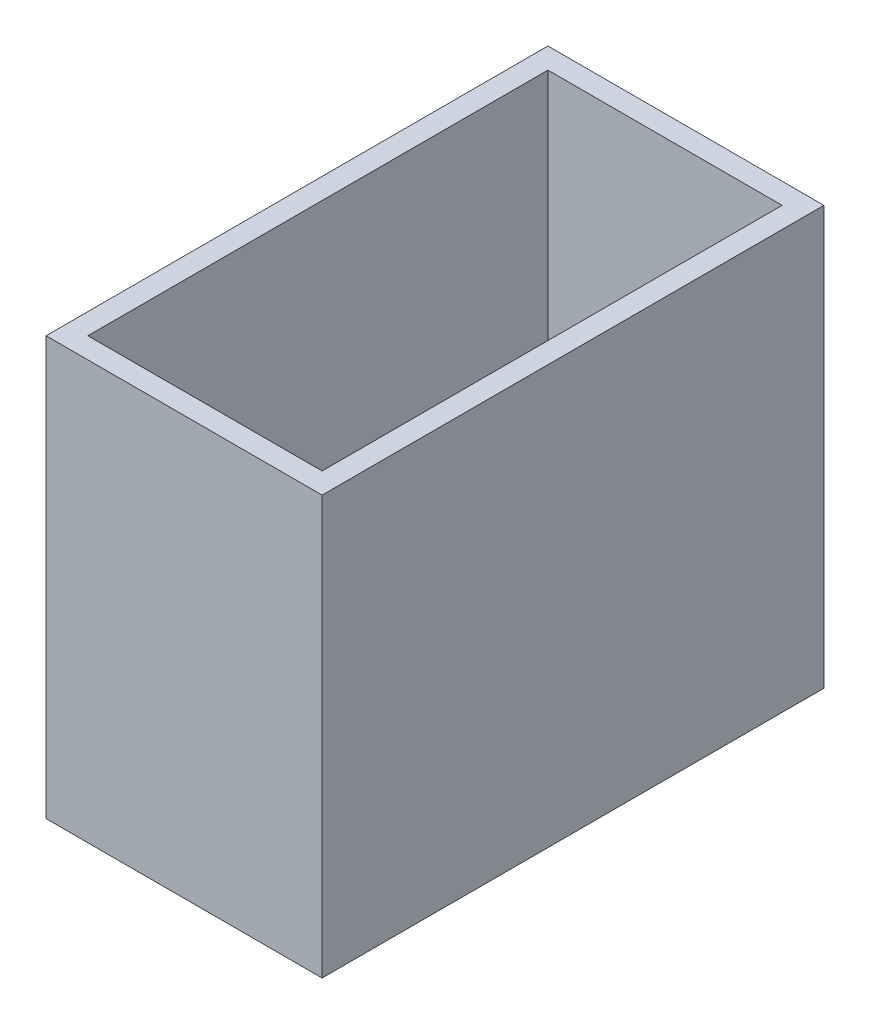
from build123d import *

# Parameters (mm, degrees)
SKETCH1_W           = 41.91
SKETCH1_H           = 76.2
SKETCH1_W_2         = 35.56
SKETCH1_H_2         = 69.85
EXTRUDE_THIN1_DEPTH = 63.5


with BuildPart() as part:
    # Sketch1 → Extrude-Thin1 (new body)
    with BuildSketch(Plane(origin=(0, 0, 0), x_dir=(1, 0, 0), z_dir=(0, 1, 0))):
        with Locations((20.955, -38.1)):
            Rectangle(SKETCH1_W, SKETCH1_H)
        with Locations((20.955, -38.1)):
            Rectangle(SKETCH1_W_2, SKETCH1_H_2, mode=Mode.SUBTRACT)
    extrude(amount=EXTRUDE_THIN1_DEPTH)


solid = part.part
